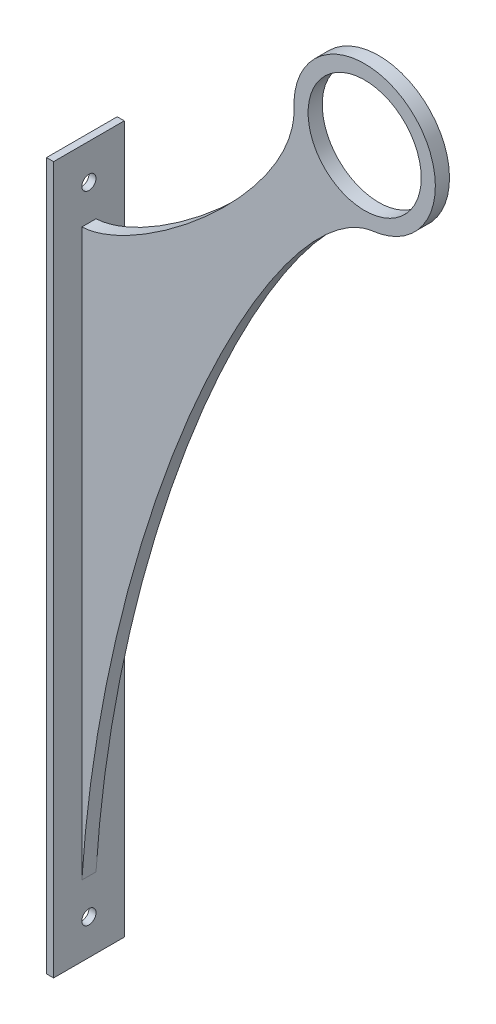
from build123d import *

# Parameters (mm, degrees)
SKETCH_1_W           = 10
SKETCH_1_H           = 100
EXTRUDE_1_DEPTH      = 1
SKETCH_2_W           = 2
SKETCH_2_H           = 30
SKETCH_2_H_2         = 10
SKETCH_2_H_3         = 80
EXTRUDE_3_DEPTH      = 50
SKETCH_3_R           = 8
CUT_EXTRUDE_11_DEPTH = 50
SKETCH_4_R           = 1
CUT_EXTRUDE_12_DEPTH = 1
SKETCH_5_R           = 1
CUT_EXTRUDE_13_DEPTH = 1


with BuildPart() as part:
    # 草图1 → 凸台-拉伸1 (new body)
    with BuildSketch(Plane(origin=(0, 0, 0), x_dir=(0, 0, -1), z_dir=(1, 0, 0))):
        Rectangle(SKETCH_1_W, SKETCH_1_H)
    extrude(amount=EXTRUDE_1_DEPTH)

    # 草图2 → 凸台-拉伸3 (add)
    with BuildSketch(Plane(origin=(1, 0, 0), x_dir=(0, 0, -1), z_dir=(1, 0, 0))):
        with Locations((0, 65)):
            Rectangle(SKETCH_2_W, SKETCH_2_H)
        with Locations((0, 45)):
            Rectangle(SKETCH_2_W, SKETCH_2_H_2)
        Rectangle(SKETCH_2_W, SKETCH_2_H_3)
    extrude(amount=EXTRUDE_3_DEPTH)

    # 草图3 → 切除-拉伸11 (cut)
    with BuildSketch(Plane.XY.offset(1)):
        with BuildLine():
            Line((1, 80), (1, 40))
            add(Edge.make_bspline(
                [(1, 40), (9.468575597, 40.414680021), (30.950220462, 58.157084532), (31.024773588, 69.296538532)],
                knots=[0, 0, 0, 0, 0.979118635, 0.979118635, 0.979118635, 0.979118635], degree=3))
            ThreePointArc((31.024773588, 69.296538532), (33.684447571, 76.817821695), (41, 80))
            Line((41, 80), (1, 80))
        make_face()
        with Locations((41, 70)):
            Circle(SKETCH_3_R)
        with BuildLine():
            add(Edge.make_bspline(
                [(1, -40), (4.194748365, 9.503139803), (28.570241109, 58.174536765), (42.100694242, 60.060760986)],
                knots=[0, 0, 0, 0, 1, 1, 1, 1], degree=3))
            Line((1, -40), (51, -40))
            Line((51, -40), (51, 70))
            ThreePointArc((51, 70), (48.450065182, 63.329428151), (42.100694242, 60.060760986))
        make_face()
        with BuildLine():
            Line((51, 80), (41, 80))
            ThreePointArc((41, 80), (48.071067812, 77.071067812), (51, 70))
            Line((51, 70), (51, 80))
        make_face()
    extrude(amount=-CUT_EXTRUDE_11_DEPTH, mode=Mode.SUBTRACT)

    # 草图4 → 切除-拉伸12 (cut)
    with BuildSketch(Plane.ZY):
        with Locations((0, 44.964354978)):
            Circle(SKETCH_4_R)
    extrude(amount=-CUT_EXTRUDE_12_DEPTH, mode=Mode.SUBTRACT)

    # 草图5 → 切除-拉伸13 (cut)
    with BuildSketch(Plane.ZY):
        with Locations((0, -45)):
            Circle(SKETCH_5_R)
    extrude(amount=-CUT_EXTRUDE_13_DEPTH, mode=Mode.SUBTRACT)


solid = part.part
